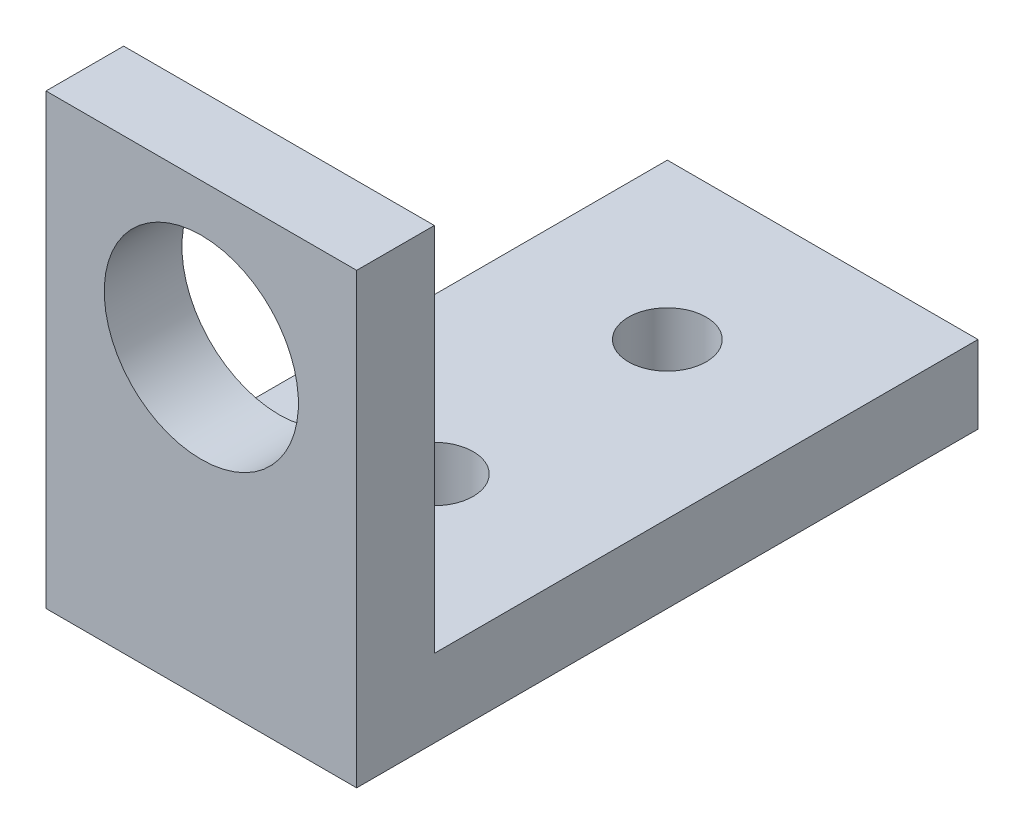
from build123d import *

# Parameters (mm, degrees)
BOSS_EXTRUDE1_DEPTH          = 25.4
CUT_EXTRUDE1_REACH           = 92.027
SKETCH2_R                    = 3.175
F_5_8_0_625_DIAMETER_HOLE1_D = 15.875
CUT_EXTRUDE2_REACH           = 97.038
SKETCH5_W                    = 25.4
SKETCH5_H                    = 39.5524608


with BuildPart() as part:
    # Sketch1 → Boss-Extrude1 (new body)
    with BuildSketch(Plane(origin=(0, 0, 0), x_dir=(0, 0, -1), z_dir=(1, 0, 0))):
        Polygon((0, 76.2), (0, 0), (50.8, 0), (50.8, 6.35), (6.35, 6.35), (6.35, 76.2), align=None)
    extrude(amount=BOSS_EXTRUDE1_DEPTH)

    # Sketch2 → Cut-Extrude1 (cut, up to next)
    with BuildSketch(Plane(origin=(0, 6.35, 0), x_dir=(1, 0, 0), z_dir=(0, 1, 0)), mode=Mode.PRIVATE) as cut_extrude1_sk1:
        with Locations(Location((12.7, 38.1, 0), (0, 0, 270))):
            Circle(SKETCH2_R)
    cut_extrude1_tool1 = extrude(cut_extrude1_sk1.sketch, amount=-CUT_EXTRUDE1_REACH, mode=Mode.PRIVATE) & part.part
    # Sketch2 → Cut-Extrude1 (cut, up to next)
    with BuildSketch(Plane(origin=(0, 6.35, 0), x_dir=(1, 0, 0), z_dir=(0, 1, 0)), mode=Mode.PRIVATE) as cut_extrude1_sk2:
        with Locations(Location((12.7, 19.05, 0), (0, 0, 270))):
            Circle(SKETCH2_R)
    cut_extrude1_tool2 = extrude(cut_extrude1_sk2.sketch, amount=-CUT_EXTRUDE1_REACH, mode=Mode.PRIVATE) & part.part
    add(cut_extrude1_tool1.solids().sort_by_distance((12.7, 6.35, -38.1))[0], mode=Mode.SUBTRACT)
    add(cut_extrude1_tool2.solids().sort_by_distance((12.7, 6.35, -19.05))[0], mode=Mode.SUBTRACT)

    # 5/8 (0.625) Diameter Hole1 (through all)
    with Locations(Plane(origin=(0, 0, -6.35), x_dir=(-1, 0, 0), z_dir=(0, 0, -1))):
        with Locations((-12.7, 57.15), (-12.7, 24.8412)):
            Hole(F_5_8_0_625_DIAMETER_HOLE1_D / 2)

    # Sketch5 → Cut-Extrude2 (cut, up to next)
    with BuildSketch(Plane.XY, mode=Mode.PRIVATE) as cut_extrude2_sk1:
        with Locations((12.7, 56.4237696)):
            Rectangle(SKETCH5_W, SKETCH5_H)
    cut_extrude2_tool1 = extrude(cut_extrude2_sk1.sketch, amount=-CUT_EXTRUDE2_REACH, mode=Mode.PRIVATE) & part.part
    add(cut_extrude2_tool1.solids().sort_by_distance((12.7, 56.42377, 0))[0], mode=Mode.SUBTRACT)


solid = part.part
